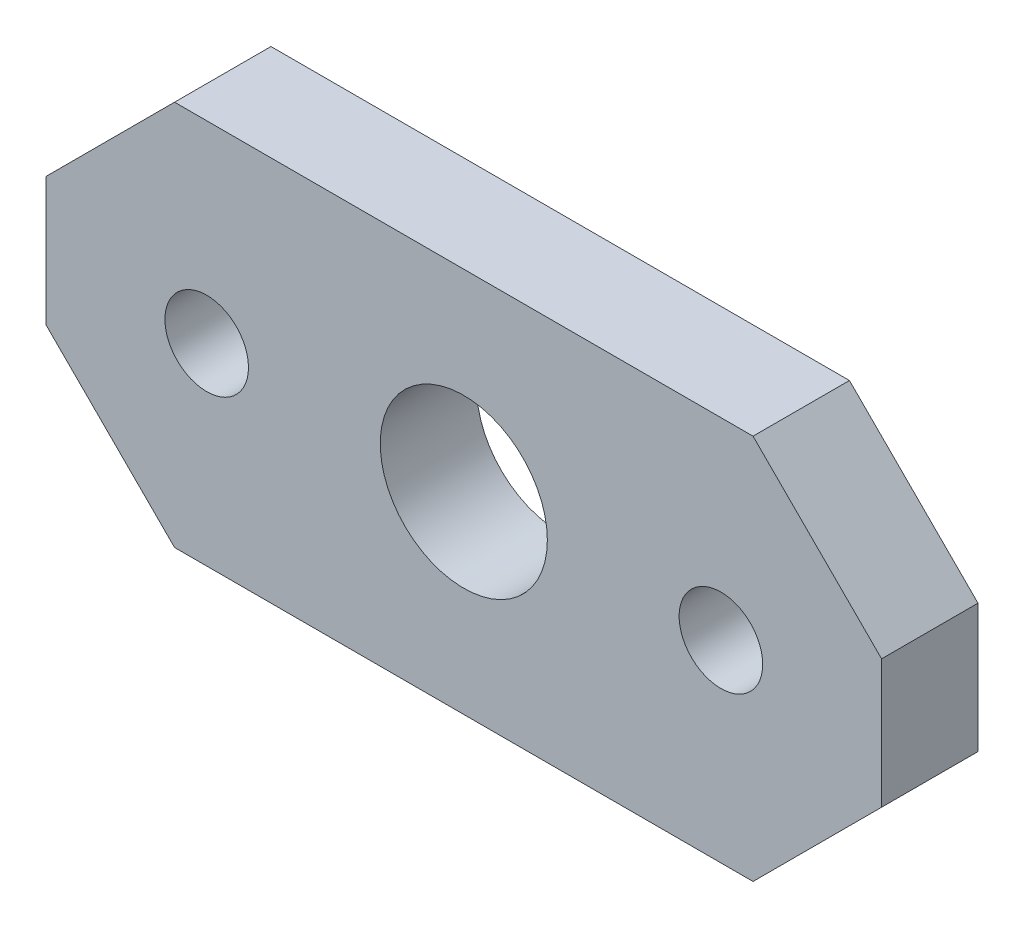
from build123d import *

# Parameters (mm, degrees)
SKETCH_1_R    = 2.6
SKETCH_1_R_2  = 1.3
M5_M2P5_DEPTH = 3


with BuildPart() as part:
    # 草图1 → M5转接毂_双M2p5折叠轴孔 (new body)
    with BuildSketch(Plane.XY):
        Polygon((-9, -6), (9, -6), (13, -2), (13, 2), (9, 6), (-9, 6), (-13, 2), (-13, -2), align=None)
        Circle(SKETCH_1_R, mode=Mode.SUBTRACT)
        with Locations((-8, 0)):
            Circle(SKETCH_1_R_2, mode=Mode.SUBTRACT)
        with Locations((8, 0)):
            Circle(SKETCH_1_R_2, mode=Mode.SUBTRACT)
    extrude(amount=M5_M2P5_DEPTH)


solid = part.part
